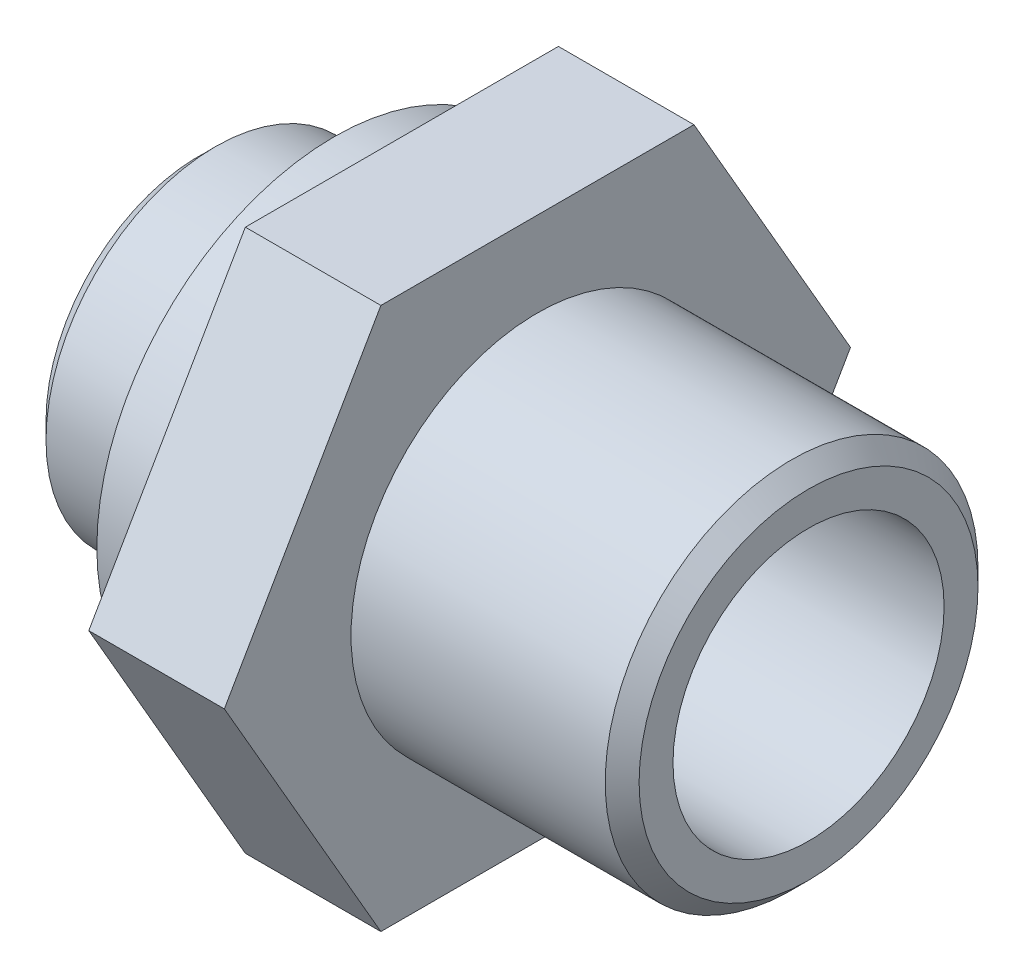
from build123d import *

# Parameters (mm, degrees)
SKETCH1_R           = 2.75
BOSS_EXTRUDE1_DEPTH = 4
BOSS_EXTRUDE2_DEPTH = 2
SKETCH3_R           = 3.5
BOSS_EXTRUDE3_DEPTH = 1
SKETCH4_R           = 2.5
BOSS_EXTRUDE4_DEPTH = 2
SKETCH5_R           = 2
CUT_EXTRUDE1_DEPTH  = 11.878112581
CHAMFER1_SIZE       = 0.25


with BuildPart() as part:
    # Sketch1 → Boss-Extrude1 (new body)
    with BuildSketch(Plane(origin=(0, 0, 0), x_dir=(0, 0, -1), z_dir=(1, 0, 0))):
        Circle(SKETCH1_R)
    extrude(amount=BOSS_EXTRUDE1_DEPTH)

    # Sketch2 → Boss-Extrude2 (add)
    with BuildSketch(Plane.ZY):
        Polygon((2.309401077, 4), (-2.309401077, 4), (-4.618802154, 0), (-2.309401077, -4), (2.309401077, -4), (4.618802154, 0), align=None)
    extrude(amount=BOSS_EXTRUDE2_DEPTH)

    # Sketch3 → Boss-Extrude3 (add)
    with BuildSketch(Plane.ZY.offset(2)):
        Circle(SKETCH3_R)
    extrude(amount=BOSS_EXTRUDE3_DEPTH)

    # Sketch4 → Boss-Extrude4 (add)
    with BuildSketch(Plane.ZY.offset(3)):
        Circle(SKETCH4_R)
    extrude(amount=BOSS_EXTRUDE4_DEPTH)

    # Sketch5 → Cut-Extrude1 (cut, through all)
    with BuildSketch(Plane.ZY.offset(5)):
        Circle(SKETCH5_R)
    extrude(amount=-CUT_EXTRUDE1_DEPTH, mode=Mode.SUBTRACT)

    # Chamfer1
    chamfer1_edges = [part.edges().sort_by_distance(p)[0] for p in [
        (-5, 0, -2.5),
        (4, 0, 2.75),
    ]]
    chamfer(chamfer1_edges, length=CHAMFER1_SIZE)


solid = part.part
